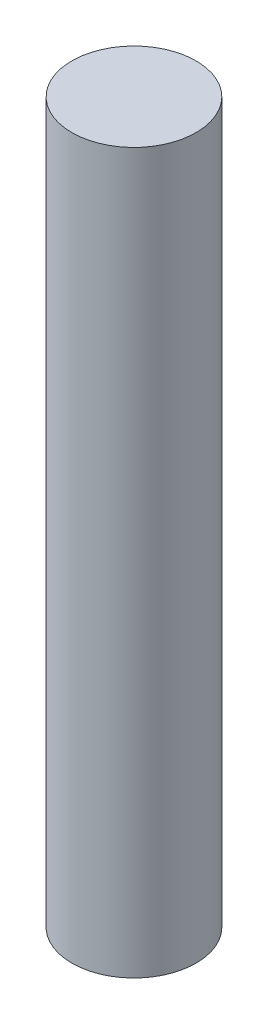
from build123d import *

# Parameters (mm, degrees)
SKETCH1_R           = 42.5
BOSS_EXTRUDE1_DEPTH = 492


with BuildPart() as part:
    # Sketch1 → Boss-Extrude1 (new body)
    with BuildSketch(Plane(origin=(0, 0, 0), x_dir=(1, 0, 0), z_dir=(0, 1, 0))):
        with Locations(Location((0, 0, 0), (0, 0, 270))):
            Circle(SKETCH1_R)
    extrude(amount=BOSS_EXTRUDE1_DEPTH)


solid = part.part
